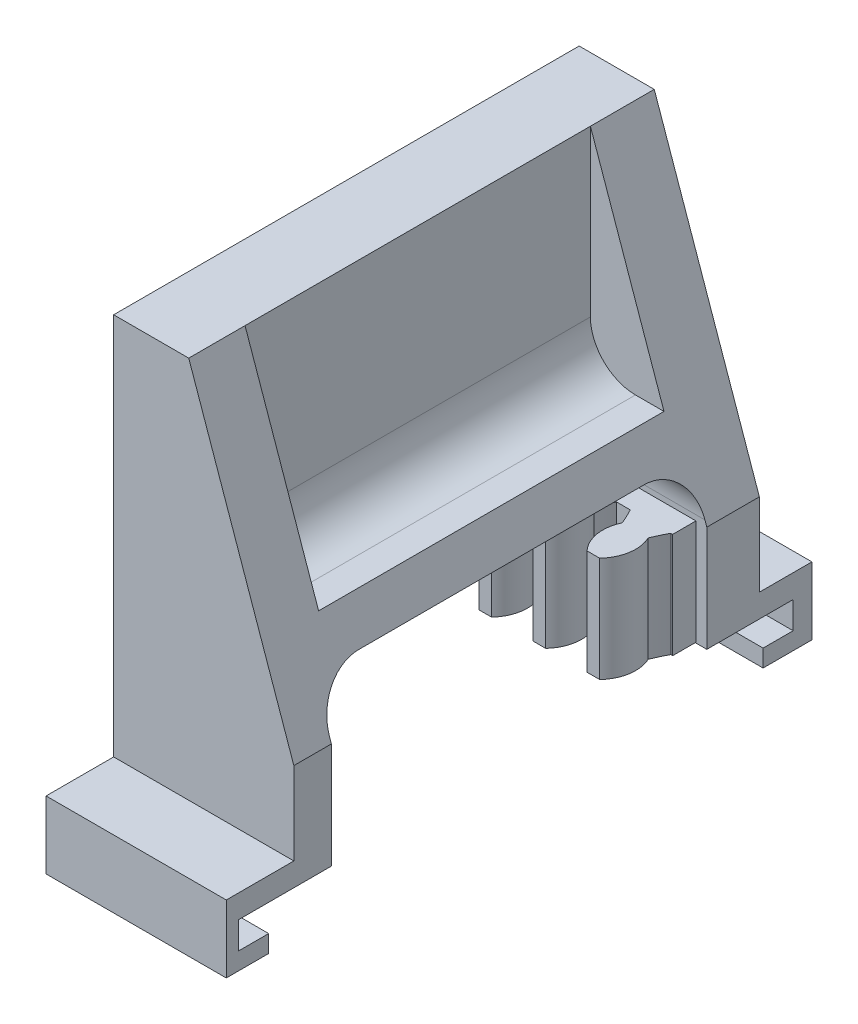
from build123d import *

# Parameters (mm, degrees)
BOSS_EXTRUDE1_DEPTH = 31
SKETCH4_W           = 25
SKETCH4_H           = 15
CUT_EXTRUDE2_DEPTH  = 25
CUT_EXTRUDE4_DEPTH  = 11.5
SKETCH7_W           = 31
SKETCH7_H           = 1.7
BOSS_EXTRUDE3_DEPTH = 7
BOSS_EXTRUDE4_DEPTH = 7
LPATTERN1_COUNT     = 8
LPATTERN1_PITCH     = 3.6
SKETCH11_W          = 12
SKETCH11_H          = 4.5
BOSS_EXTRUDE5_DEPTH = 3.5
FILLET5_R           = 3
SKETCH12_W          = 12
SKETCH12_H          = 4.5
BOSS_EXTRUDE6_DEPTH = 4.5
CUT_EXTRUDE5_DEPTH  = 12


with BuildPart() as part:
    # Sketch1 → Boss-Extrude1 (new body)
    with BuildSketch(Plane.XY):
        Polygon((0, 0), (0, -30), (12, -30), (12, -20), (5, 0), align=None)
    extrude(amount=-BOSS_EXTRUDE1_DEPTH)

    # Sketch4 → Cut-Extrude2 (cut)
    with BuildSketch(Plane.ZY):
        with Locations((-15, -24.143402944)):
            Rectangle(SKETCH4_W, SKETCH4_H)
    extrude(amount=-CUT_EXTRUDE2_DEPTH, mode=Mode.SUBTRACT)

    # Sketch6 → Cut-Extrude4 (cut, symmetric)
    with BuildSketch(Plane.XY.offset(-15.25)):
        Polygon((5, 0), (5, -14), (9.9, -14), align=None)
    extrude(amount=CUT_EXTRUDE4_DEPTH, both=True, mode=Mode.SUBTRACT)

    # Sketch7 → Boss-Extrude3 (add)
    with BuildSketch(Plane(origin=(0, -27, 0), x_dir=(1, 0, 0), z_dir=(0, 1, 0))):
        with Locations((-4.2231607, 26.8)):
            Rectangle(SKETCH7_W, SKETCH7_H)
    extrude(amount=BOSS_EXTRUDE3_DEPTH)

    # Sketch10 → Boss-Extrude4 (add)
    with BuildSketch(Plane(origin=(0, -27, 0), x_dir=(1, 0, 0), z_dir=(0, 1, 0))):
        with BuildLine():
            Line((10.226247744, 22.144145979), (9.378053282, 22.144145979))
            ThreePointArc((9.378053282, 22.144145979), (8.729742796, 23.468564149), (8.93378471, 24.928960283))
            ThreePointArc((8.93378471, 24.928960283), (8.707970922, 25.446557347), (8.452150513, 25.95))
            Line((8.452150513, 25.95), (11.152150513, 25.95))
            ThreePointArc((11.152150513, 25.95), (10.896330104, 25.446557347), (10.670516315, 24.928960283))
            ThreePointArc((10.670516315, 24.928960283), (10.874558229, 23.468564149), (10.226247744, 22.144145979))
        make_face()
    boss_extrude4 = extrude(amount=BOSS_EXTRUDE4_DEPTH)

    # LPattern1: Boss-Extrude4 ×8
    with Locations(*[(-i * LPATTERN1_PITCH, 0, 0) for i in range(1, LPATTERN1_COUNT)]):
        add(boss_extrude4)

    # Sketch11 → Boss-Extrude5 (add)
    with BuildSketch(Plane(origin=(0, 0, -31), x_dir=(-1, 0, 0), z_dir=(0, 0, -1))):
        with Locations((-6, -27.75)):
            Rectangle(SKETCH11_W, SKETCH11_H)
    extrude(amount=BOSS_EXTRUDE5_DEPTH)

    # Fillet5
    fillet5_edges = [part.edges().sort_by_distance(p)[0] for p in [
        (5.412595515, -16.643402944, -27.5),
        (5.412595515, -16.643402944, -2.5),
        (5, -14, -15.25),
    ]]
    fillet(fillet5_edges, radius=FILLET5_R)

    # Sketch12 → Boss-Extrude6 (add)
    with BuildSketch(Plane.XY):
        with Locations((6, -27.75)):
            Rectangle(SKETCH12_W, SKETCH12_H)
    extrude(amount=BOSS_EXTRUDE6_DEPTH)

    # Sketch13 → Cut-Extrude5 (cut)
    with BuildSketch(Plane.ZY):
        Polygon((-33.25, -27.047861031), (-26.75, -27.047861031), (-26.75, -32.047861031), (-31.25, -32.047861031), (-31.25, -28.847861031), (-33.25, -28.847861031), align=None)
        Polygon((1.676178687, -28.847861031), (3.676178687, -28.847861031), (3.676178687, -27.047861031), (-2.823821313, -27.047861031), (-2.823821313, -32.047861031), (1.676178687, -32.047861031), align=None)
    extrude(amount=-CUT_EXTRUDE5_DEPTH, mode=Mode.SUBTRACT)


solid = part.part
